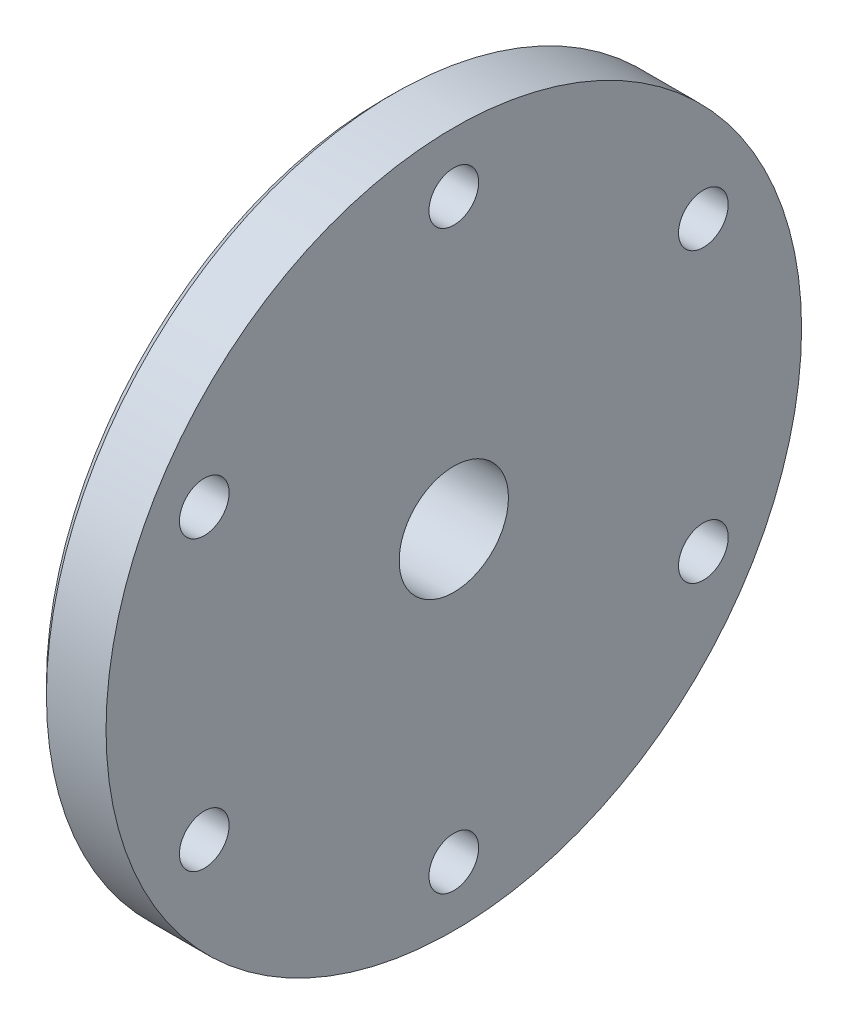
from build123d import *

# Parameters (mm, degrees)
SCHIZZO1_W               = 7
SCHIZZO1_H               = 35
SCHIZZO2_R               = 2.5
TAGLIO_ESTRUSIONE1_DEPTH = 50.989999
SCHIZZO3_R               = 5.5
TAGLIO_ESTRUSIONE2_DEPTH = 8
RACCORDO1_R              = 1
SMUSSO1_SIZE             = 1


with BuildPart() as part:
    # Schizzo1 → Rivoluzione1 (revolve)
    with BuildSketch(Plane(origin=(0, 0, 0), x_dir=(1, 0, 0), z_dir=(0, 1, 0)), mode=Mode.PRIVATE) as rivoluzione1_sk:
        Polygon((-7, -24), (-7, 0), (-12, 0), (-12, -10), align=None)
        with Locations((-3.5, -17.5)):
            Rectangle(SCHIZZO1_W, SCHIZZO1_H)
    revolve(rivoluzione1_sk.sketch.rotate(Axis((0, 0, 0), (-1, 0, 0)), 180), axis=Axis((0, 0, 0), (-1, 0, 0)))

    # Schizzo2 → Taglio-Estrusione1 (cut, through all)
    with BuildSketch(Plane.ZY.offset(7)):
        with Locations((0, 29)):
            Circle(SCHIZZO2_R)
        with Locations((-25.11473671, 14.5)):
            Circle(SCHIZZO2_R)
        with Locations((-25.11473671, -14.5)):
            Circle(SCHIZZO2_R)
        with Locations((0, -29)):
            Circle(SCHIZZO2_R)
        with Locations((25.11473671, -14.5)):
            Circle(SCHIZZO2_R)
        with Locations((25.11473671, 14.5)):
            Circle(SCHIZZO2_R)
    extrude(amount=-TAGLIO_ESTRUSIONE1_DEPTH, mode=Mode.SUBTRACT)

    # Schizzo3 → Taglio-Estrusione2 (cut)
    with BuildSketch(Plane(origin=(0, 0, 0), x_dir=(0, 0, -1), z_dir=(1, 0, 0))):
        Circle(SCHIZZO3_R)
    extrude(amount=-TAGLIO_ESTRUSIONE2_DEPTH, mode=Mode.SUBTRACT)

    # Raccordo1
    raccordo1_edges = [part.edges().sort_by_distance(p)[0] for p in [
        (-7, 0, 24),
    ]]
    fillet(raccordo1_edges, radius=RACCORDO1_R)

    # Smusso1
    smusso1_edges = [part.edges().sort_by_distance(p)[0] for p in [
        (-7, 0, 35),
    ]]
    chamfer(smusso1_edges, length=SMUSSO1_SIZE)


solid = part.part
